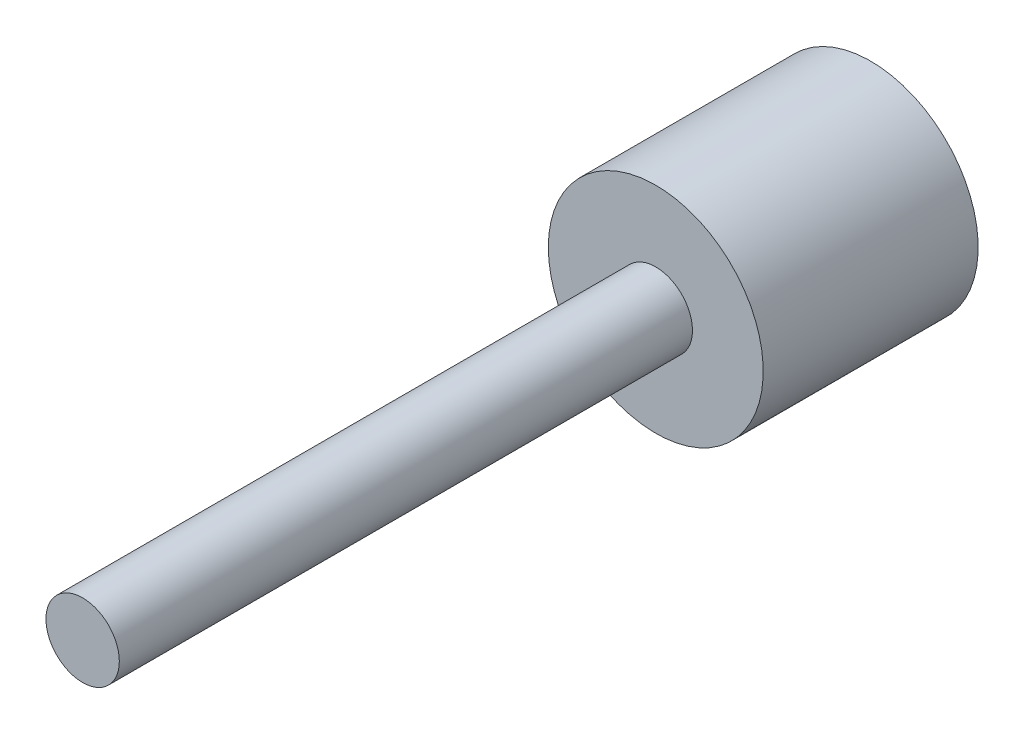
from build123d import *

# Parameters (mm, degrees)
SKETCH2_R           = 19.05
BOSS_EXTRUDE1_DEPTH = 38.1
SKETCH3_R           = 6.505272566
BOSS_EXTRUDE2_DEPTH = 101.6


with BuildPart() as part:
    # Sketch2 → Boss-Extrude1 (new body)
    with BuildSketch(Plane.XY):
        with Locations(Location((0, 0, 0), (0, 0, 180))):
            Circle(SKETCH2_R)
    extrude(amount=BOSS_EXTRUDE1_DEPTH)

    # Sketch3 → Boss-Extrude2 (add)
    with BuildSketch(Plane.XY.offset(38.1)):
        Circle(SKETCH3_R)
    extrude(amount=BOSS_EXTRUDE2_DEPTH)


solid = part.part
